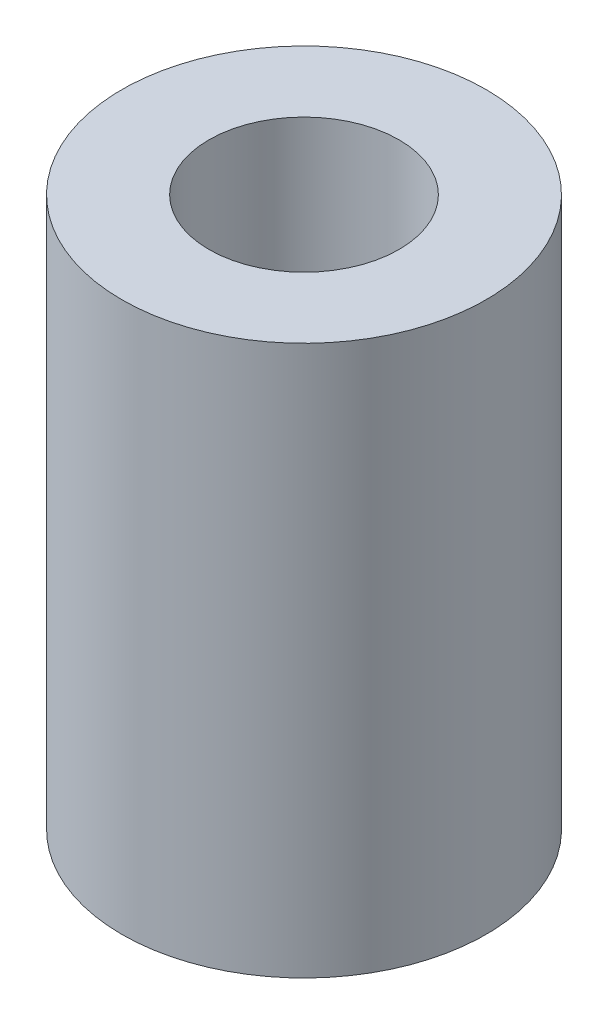
from build123d import *

# Parameters (mm, degrees)
SKETCH1_R           = 3.975
SKETCH1_R_2         = 2.075
BOSS_EXTRUDE1_DEPTH = 12


with BuildPart() as part:
    # Sketch1 → Boss-Extrude1 (new body)
    with BuildSketch(Plane(origin=(0, 0, 0), x_dir=(1, 0, 0), z_dir=(0, 1, 0))):
        with Locations(Location((0, 0, 0), (0, 0, 270))):
            Circle(SKETCH1_R)
        with Locations(Location((0, 0, 0), (0, 0, 270))):
            Circle(SKETCH1_R_2, mode=Mode.SUBTRACT)
    extrude(amount=BOSS_EXTRUDE1_DEPTH)


solid = part.part
